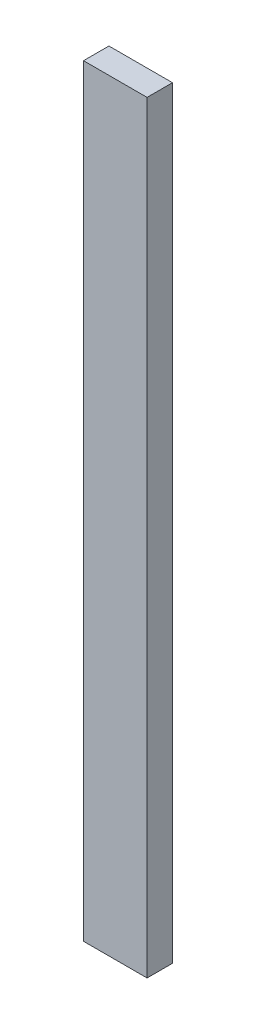
from build123d import *

# Parameters (mm, degrees)
SKETCH1_W           = 50
SKETCH1_H           = 20
BOSS_EXTRUDE1_DEPTH = 300


with BuildPart() as part:
    # Sketch1 → Boss-Extrude1 (new, symmetric)
    with BuildSketch(Plane(origin=(0, 0, 0), x_dir=(1, 0, 0), z_dir=(0, 1, 0))):
        Rectangle(SKETCH1_W, SKETCH1_H)
    extrude(amount=BOSS_EXTRUDE1_DEPTH, both=True)


solid = part.part
